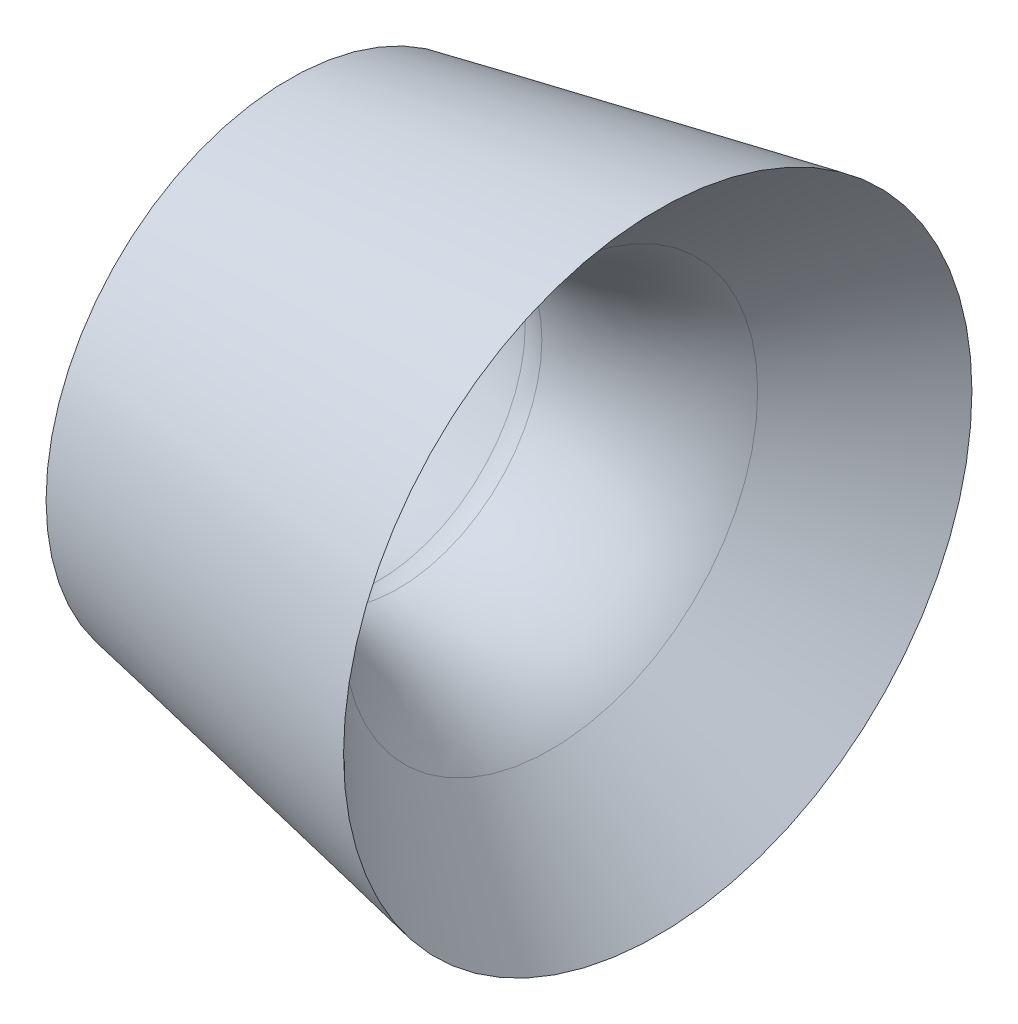
from build123d import *


with BuildPart() as part:
    # Sketch1 → Revolve1 (revolve)
    with BuildSketch(Plane.XY, mode=Mode.PRIVATE) as revolve1_sk:
        with BuildLine():
            Line((0, 24.47201236), (-8.342554344, 16.129458016))
            ThreePointArc((-8.342554344, 16.129458016), (-13.795859409, 12.485676065), (-20.228471328, 11.20615))
            ThreePointArc((-20.228471328, 11.20615), (-21.050051224, 11.285730291), (-21.841084334, 11.521512325))
            ThreePointArc((-21.841084334, 11.521512325), (-25.262342288, 12.886529827), (-28.701365604, 14.20615))
            Line((-28.701365604, 14.20615), (-28.701365604, 18.941189381))
            Line((-28.701365604, 18.941189381), (0, 24.47201236))
        make_face()
    revolve(revolve1_sk.sketch.rotate(Axis((0, 0, 0), (-1, 0, 0)), 90), axis=Axis((0, 0, 0), (-1, 0, 0)))


solid = part.part
